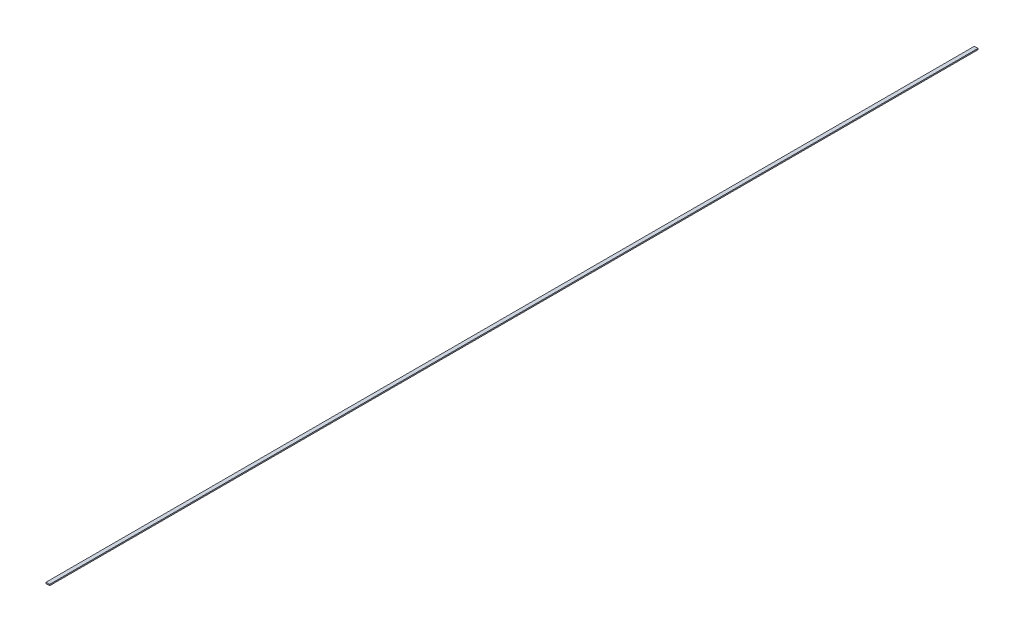
from build123d import *

# Parameters (mm, degrees)
SKETCH_1_W      = 3
SKETCH_1_H      = 1
EXTRUDE_1_DEPTH = 759.5


with BuildPart() as part:
    # 草图1 → 凸台-拉伸1 (new body)
    with BuildSketch(Plane.XY):
        with Locations((150.374543179, -5.69181804)):
            Rectangle(SKETCH_1_W, SKETCH_1_H)
    extrude(amount=EXTRUDE_1_DEPTH)


solid = part.part
